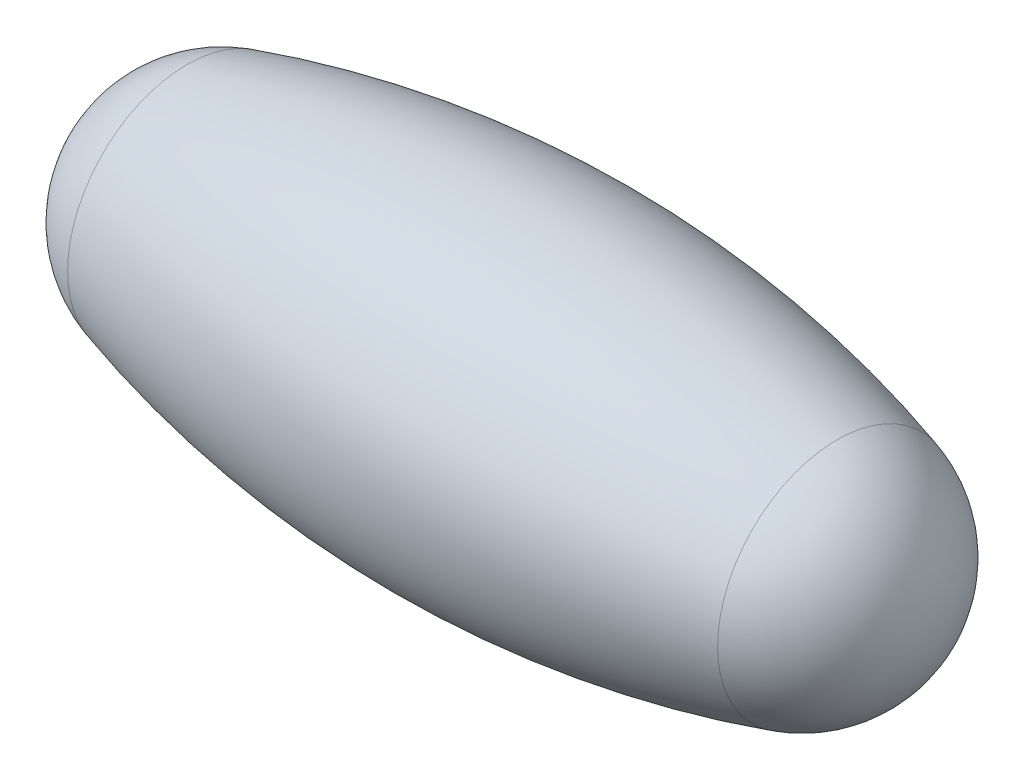
from build123d import *


with BuildPart() as part:
    # Sketch1 → Revolve1 (revolve)
    with BuildSketch(Plane.XY, mode=Mode.PRIVATE) as revolve1_sk:
        with BuildLine():
            Line((-63.5, 0), (63.5, 0))
            ThreePointArc((63.5, 0), (59.69, 11.43), (49.784, 18.288))
            ThreePointArc((49.784, 18.288), (0, 25.4), (-49.784, 18.288))
            ThreePointArc((-49.784, 18.288), (-59.69, 11.43), (-63.5, 0))
        make_face()
    revolve(revolve1_sk.sketch.rotate(Axis((-63.5, 0, 0), (1, 0, 0)), 90), axis=Axis((-63.5, 0, 0), (1, 0, 0)))


solid = part.part
